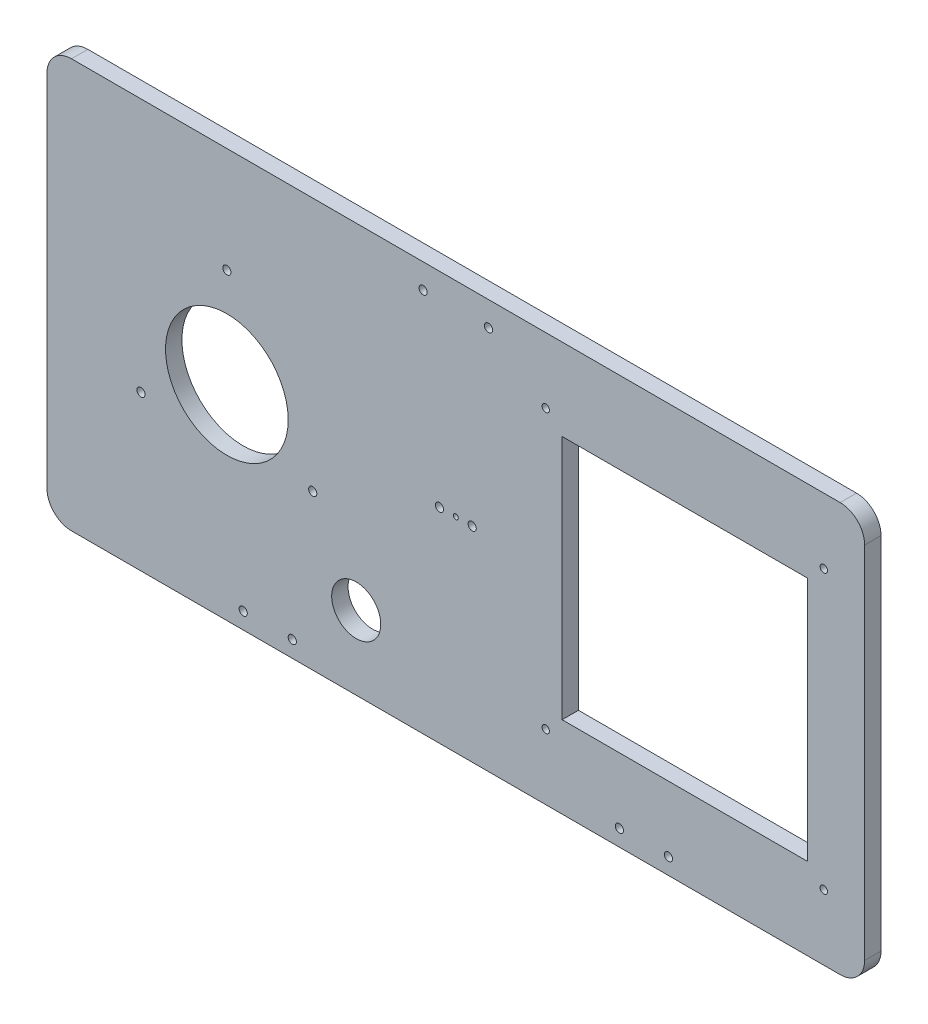
from build123d import *

# Parameters (mm, degrees)
CROQUIS1_R              = 2.5
CROQUIS1_R_2            = 37.5
CROQUIS1_R_3            = 15
CROQUIS1_R_4            = 2.25
CROQUIS1_R_5            = 1.5
CROQUIS1_W              = 150
CROQUIS1_H              = 150
SALIENTE_EXTRUIR1_DEPTH = 10


with BuildPart() as part:
    # Croquis1 → Saliente-Extruir1 (new body)
    with BuildSketch(Plane.XY):
        with BuildLine():
            Line((15, 0), (485, 0))
            ThreePointArc((485, 0), (495.606601718, 4.393398282), (500, 15))
            Line((500, 15), (500, 235))
            ThreePointArc((500, 235), (495.606601718, 245.606601718), (485, 250))
            Line((485, 250), (15, 250))
            ThreePointArc((15, 250), (4.393398282, 245.606601718), (0, 235))
            Line((0, 235), (0, 15))
            ThreePointArc((0, 15), (4.393398282, 4.393398282), (15, 0))
        make_face()
        with Locations((110, 185.621778265)):
            Circle(CROQUIS1_R, mode=Mode.SUBTRACT)
        with Locations((162.5, 94.689110868)):
            Circle(CROQUIS1_R, mode=Mode.SUBTRACT)
        with Locations((57.5, 94.689110868)):
            Circle(CROQUIS1_R, mode=Mode.SUBTRACT)
        with Locations((110, 125)):
            Circle(CROQUIS1_R_2, mode=Mode.SUBTRACT)
        with Locations((230, 235)):
            Circle(CROQUIS1_R, mode=Mode.SUBTRACT)
        with Locations((270, 235)):
            Circle(CROQUIS1_R, mode=Mode.SUBTRACT)
        with Locations((189.096460098, 45)):
            Circle(CROQUIS1_R_3, mode=Mode.SUBTRACT)
        with Locations((475, 210)):
            Circle(CROQUIS1_R_4, mode=Mode.SUBTRACT)
        with Locations((305, 210)):
            Circle(CROQUIS1_R_4, mode=Mode.SUBTRACT)
        with Locations((305, 40)):
            Circle(CROQUIS1_R_4, mode=Mode.SUBTRACT)
        with Locations((475, 40)):
            Circle(CROQUIS1_R_4, mode=Mode.SUBTRACT)
        with Locations((350, 10)):
            Circle(CROQUIS1_R, mode=Mode.SUBTRACT)
        with Locations((380, 10)):
            Circle(CROQUIS1_R, mode=Mode.SUBTRACT)
        with Locations(Location((120, 10, 0), (0, 0, 180))):
            Circle(CROQUIS1_R, mode=Mode.SUBTRACT)
        with Locations(Location((150, 10, 0), (0, 0, 180))):
            Circle(CROQUIS1_R, mode=Mode.SUBTRACT)
        with Locations((240, 125)):
            Circle(CROQUIS1_R, mode=Mode.SUBTRACT)
        with Locations((260, 125)):
            Circle(CROQUIS1_R, mode=Mode.SUBTRACT)
        with Locations((250, 125)):
            Circle(CROQUIS1_R_5, mode=Mode.SUBTRACT)
        with Locations((390, 125)):
            Rectangle(CROQUIS1_W, CROQUIS1_H, mode=Mode.SUBTRACT)
    extrude(amount=SALIENTE_EXTRUIR1_DEPTH)


solid = part.part
